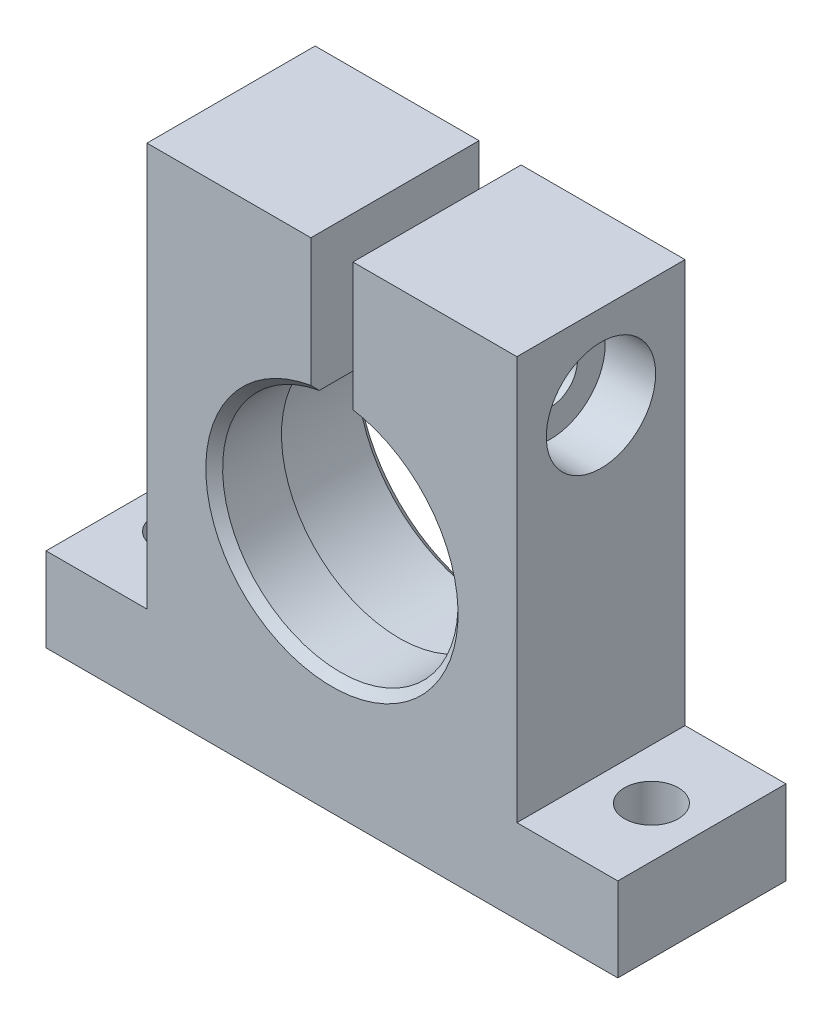
from build123d import *

# Parameters (mm, degrees)
SKETCH1_W                      = 22
SKETCH1_H                      = 29
BOSS_EXTRUDE1_DEPTH            = 5
SKETCH3_W                      = 34
SKETCH3_H                      = 10
BOSS_EXTRUDE2_DEPTH            = 5
F_16_0_16_DIAMETER_HOLE1_D     = 16
F_16_0_16_DIAMETER_HOLE1_DEPTH = 6
F_14_0_14_DIAMETER_HOLE1_D     = 14
M3_CLEARANCE_HOLE1_D           = 3.2
SKETCH12_W                     = 2.5
SKETCH12_H                     = 8.112511343
CUT_EXTRUDE1_DEPTH             = 25.779023387
M3X0_5_TAPPED_HOLE1_D          = 2.5
M3X0_5_TAPPED_HOLE1_DEPTH      = 9.75
CBORE_FOR_M3_SHCS1_D           = 3.2
CBORE_FOR_M3_SHCS1_DEPTH       = 9.75
CBORE_FOR_M3_SHCS1_CBORE_D     = 6.5
CBORE_FOR_M3_SHCS1_CBORE_DEPTH = 3
CHAMFER1_SIZE                  = 0.5


with BuildPart() as part:
    # Sketch1 → Boss-Extrude1 (new, symmetric)
    with BuildSketch(Plane.XY):
        with Locations((0, 0.5)):
            Rectangle(SKETCH1_W, SKETCH1_H)
    extrude(amount=BOSS_EXTRUDE1_DEPTH, both=True)

    # Sketch3 → Boss-Extrude2 (add)
    with BuildSketch(Plane.XZ.offset(14)):
        Rectangle(SKETCH3_W, SKETCH3_H)
    extrude(amount=-BOSS_EXTRUDE2_DEPTH)

    # Ø16.0 (16) Diameter Hole1
    with Locations(Plane(origin=(0, 0, -5), x_dir=(-1, 0, 0), z_dir=(0, 0, -1))):
        with Locations((0, 0)):
            Hole(F_16_0_16_DIAMETER_HOLE1_D / 2, depth=F_16_0_16_DIAMETER_HOLE1_DEPTH)

    # Ø14.0 (14) Diameter Hole1 (through all)
    with Locations(Plane(origin=(0, 0, 1), x_dir=(-1, 0, 0), z_dir=(0, 0, -1))):
        with Locations((0, 0)):
            Hole(F_14_0_14_DIAMETER_HOLE1_D / 2)

    # M3 Clearance Hole1 (through all)
    with Locations(Plane(origin=(0, -9, 0), x_dir=(1, 0, 0), z_dir=(0, 1, 0))):
        with Locations((-14, 0), (14, 0)):
            Hole(M3_CLEARANCE_HOLE1_D / 2)

    # Sketch12 → Cut-Extrude1 (cut, through all)
    with BuildSketch(Plane.XY.offset(5)):
        with Locations((0, 10.943744329)):
            Rectangle(SKETCH12_W, SKETCH12_H)
    extrude(amount=-CUT_EXTRUDE1_DEPTH, mode=Mode.SUBTRACT)

    # M3x0.5 Tapped Hole1
    with Locations(Plane.ZY.offset(11)):
        with Locations((0, 10)):
            Hole(M3X0_5_TAPPED_HOLE1_D / 2, depth=M3X0_5_TAPPED_HOLE1_DEPTH)

    # CBORE for M3 SHCS1
    with Locations(Plane(origin=(11, 0, 0), x_dir=(0, 0, -1), z_dir=(1, 0, 0))):
        with Locations((0, 10)):
            CounterBoreHole(CBORE_FOR_M3_SHCS1_D / 2, CBORE_FOR_M3_SHCS1_CBORE_D / 2, CBORE_FOR_M3_SHCS1_CBORE_DEPTH, depth=CBORE_FOR_M3_SHCS1_DEPTH)

    # Chamfer1
    chamfer1_edges = [part.edges().sort_by_distance(p)[0] for p in [
        (0, -7, 5),
        (0, -8, -5),
        (-11, 10, 1.25),
    ]]
    chamfer(chamfer1_edges, length=CHAMFER1_SIZE)


solid = part.part
